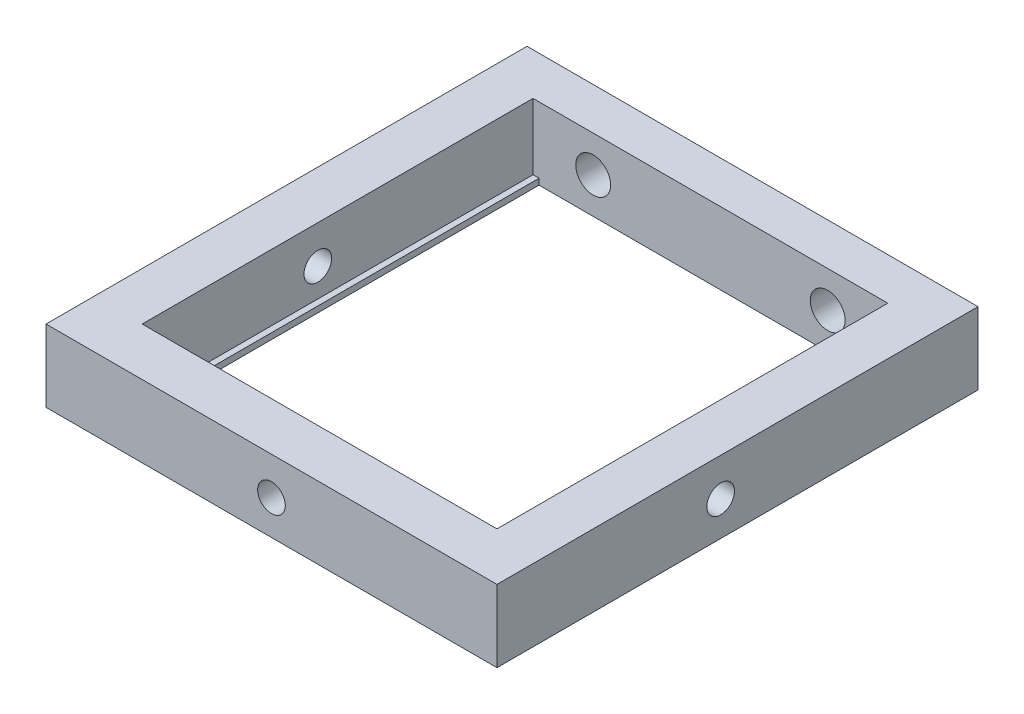
from build123d import *

# Parameters (mm, degrees)
SKETCH1_W           = 75
SKETCH1_H           = 80
BOSS_EXTRUDE1_DEPTH = 12
SKETCH2_W           = 59
SKETCH2_H           = 65
CUT_EXTRUDE1_DEPTH  = 11
SKETCH3_W           = 55
SKETCH3_H           = 63
CUT_EXTRUDE2_DEPTH  = 56.921820428
SKETCH5_R           = 2.9
CUT_EXTRUDE4_DEPTH  = 7
SKETCH7_W           = 57
SKETCH7_H           = 64
CUT_EXTRUDE5_DEPTH  = 56.921820428
SKETCH9_R           = 2.3
CUT_EXTRUDE6_DEPTH  = 8
SKETCH10_R          = 2.3
CUT_EXTRUDE7_DEPTH  = 86.842879728


with BuildPart() as part:
    # Sketch1 → Boss-Extrude1 (new body)
    with BuildSketch(Plane(origin=(0, 0, 0), x_dir=(1, 0, 0), z_dir=(0, 1, 0))):
        Rectangle(SKETCH1_W, SKETCH1_H)
    extrude(amount=BOSS_EXTRUDE1_DEPTH)

    # Sketch2 → Cut-Extrude1 (cut)
    with BuildSketch(Plane(origin=(0, 12, 0), x_dir=(1, 0, 0), z_dir=(0, 1, 0))):
        with Locations((0, 0.5)):
            Rectangle(SKETCH2_W, SKETCH2_H)
    extrude(amount=-CUT_EXTRUDE1_DEPTH, mode=Mode.SUBTRACT)

    # Sketch3 → Cut-Extrude2 (cut, through all)
    with BuildSketch(Plane(origin=(0, 1, 0), x_dir=(1, 0, 0), z_dir=(0, 1, 0))):
        with Locations((0, 1.5)):
            Rectangle(SKETCH3_W, SKETCH3_H)
    extrude(amount=-CUT_EXTRUDE2_DEPTH, mode=Mode.SUBTRACT)

    # Sketch5 → Cut-Extrude4 (cut)
    with BuildSketch(Plane(origin=(0, 0, -40), x_dir=(-1, 0, 0), z_dir=(0, 0, -1))):
        with Locations((-19.5, 5.962429795)):
            Circle(SKETCH5_R)
        with Locations((19.5, 5.962429795)):
            Circle(SKETCH5_R)
    extrude(amount=-CUT_EXTRUDE4_DEPTH, mode=Mode.SUBTRACT)

    # Sketch7 → Cut-Extrude5 (cut, through all)
    with BuildSketch(Plane(origin=(0, 1, 0), x_dir=(1, 0, 0), z_dir=(0, 1, 0))):
        with Locations((0, 1)):
            Rectangle(SKETCH7_W, SKETCH7_H)
    extrude(amount=-CUT_EXTRUDE5_DEPTH, mode=Mode.SUBTRACT)

    # Sketch9 → Cut-Extrude6 (cut)
    with BuildSketch(Plane.XY.offset(40)):
        with Locations((0, 5.75)):
            Circle(SKETCH9_R)
    extrude(amount=-CUT_EXTRUDE6_DEPTH, mode=Mode.SUBTRACT)

    # Sketch10 → Cut-Extrude7 (cut, through all)
    with BuildSketch(Plane(origin=(37.5, 0, 0), x_dir=(0, 0, -1), z_dir=(1, 0, 0))):
        with Locations((-2.8, 5.719569138)):
            Circle(SKETCH10_R)
    extrude(amount=-CUT_EXTRUDE7_DEPTH, mode=Mode.SUBTRACT)


solid = part.part
